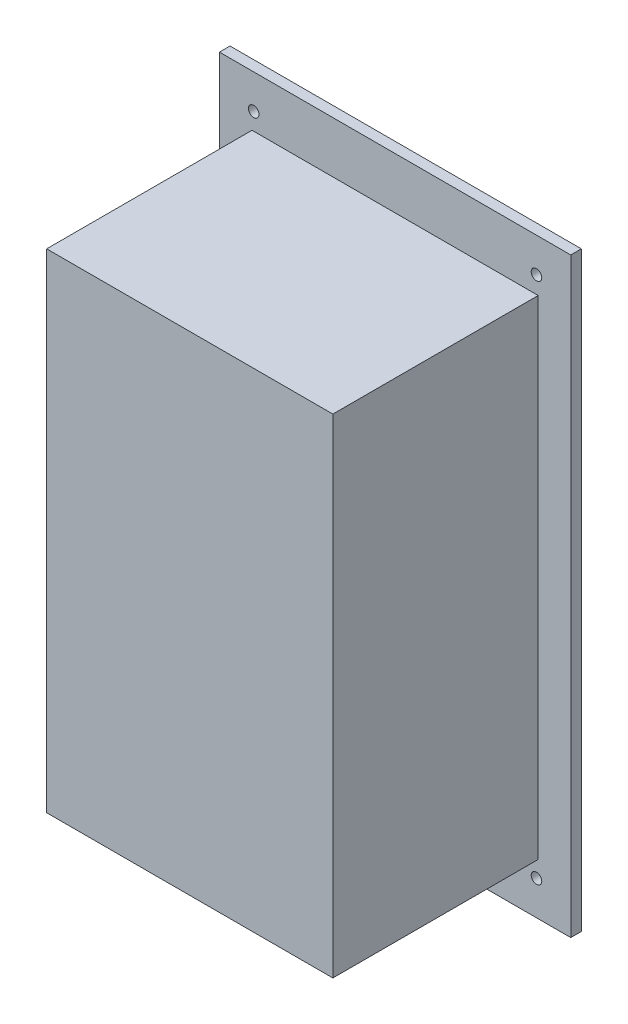
from build123d import *

# Parameters (mm, degrees)
BOX_SKETCH_W              = 33.4
BOX_SKETCH_H              = 57
BOX_EXTRUDE_DEPTH         = 25.2
FLANGE_SKETCH_W           = 41
FLANGE_SKETCH_H           = 69
FLANGE_EXTRUDE_DEPTH      = 1.23456789
MOUNTHOLES_CUT_DEPTH      = 48.387129054
MOUNTHOLES_CUT_DEPTH_BACK = 48.387129054
MOUNTHOLES_SKETCH_R       = 0.617283945


with BuildPart() as part:
    # box_sketch → box_extrude (new body)
    with BuildSketch(Plane.XY):
        Rectangle(BOX_SKETCH_W, BOX_SKETCH_H)
    extrude(amount=BOX_EXTRUDE_DEPTH)

    # flange_sketch → flange_extrude (add)
    with BuildSketch(Plane.XY):
        Rectangle(FLANGE_SKETCH_W, FLANGE_SKETCH_H)
    extrude(amount=FLANGE_EXTRUDE_DEPTH)

    # mountHoles_sketch → mountHoles_cut (cut, two sides: drawn at the far end of the back side and taken through both)
    with BuildSketch(Plane.XY.offset(-MOUNTHOLES_CUT_DEPTH_BACK)):
        with Locations((16.5, -30.5)):
            Circle(MOUNTHOLES_SKETCH_R)
        with Locations((16.5, 30.5)):
            Circle(MOUNTHOLES_SKETCH_R)
        with Locations((-16.5, -30.5)):
            Circle(MOUNTHOLES_SKETCH_R)
        with Locations((-16.5, 30.5)):
            Circle(MOUNTHOLES_SKETCH_R)
    extrude(amount=MOUNTHOLES_CUT_DEPTH + MOUNTHOLES_CUT_DEPTH_BACK, mode=Mode.SUBTRACT)


solid = part.part
